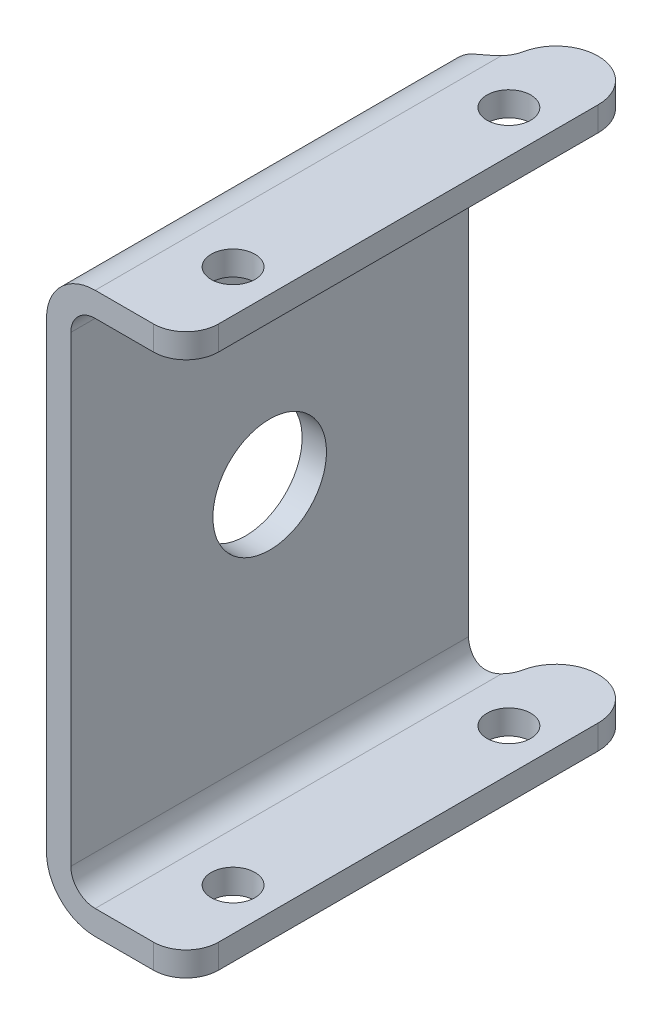
from build123d import *

# Parameters (mm, degrees)
BOSS_EXTRUDE1_DEPTH = 14
SKETCH2_R           = 1.35
CUT_EXTRUDE1_DEPTH  = 39.212694226
SKETCH4_R           = 1.742727666
CUT_EXTRUDE3_DEPTH  = 39.212694226
SKETCH3_R           = 3.5
CUT_EXTRUDE2_DEPTH  = 39.212694226
FILLET1_R           = 3
FILLET2_R           = 2
FILLET3_R           = 1.5


with BuildPart() as part:
    # Sketch1 → Boss-Extrude1 (new, symmetric)
    with BuildSketch(Plane.XY):
        Polygon((0, 0), (0, 34.5), (8.6, 34.5), (8.6, 33), (1.5, 33), (1.5, 1.5), (8.6, 1.5), (8.6, 0), align=None)
    extrude(amount=BOSS_EXTRUDE1_DEPTH, both=True)

    # Sketch2 → Cut-Extrude1 (cut, through all)
    with BuildSketch(Plane(origin=(0, 34.5, 0), x_dir=(1, 0, 0), z_dir=(0, 1, 0))):
        with Locations(Location((6, 8.5, 0), (0, 0, 180))):
            Circle(SKETCH2_R)
        with Locations(Location((6, -8.5, 0), (0, 0, 180))):
            Circle(SKETCH2_R)
    extrude(amount=-CUT_EXTRUDE1_DEPTH, mode=Mode.SUBTRACT)

    # Sketch4 → Cut-Extrude3 (cut, through all)
    with BuildSketch(Plane(origin=(0, 34.5, 0), x_dir=(1, 0, 0), z_dir=(0, 1, 0))):
        with BuildLine():
            Line((8.6, 14), (6, 14))
            ThreePointArc((6, 14), (7.838477631, 13.238477631), (8.6, 11.4))
            Line((8.6, 11.4), (8.6, 14))
        make_face()
        Polygon((0, 14.708926335), (0, 14), (1.742727666, 14), (6, 14), (8.6, 14), (8.6, 11.4), (10.428656455, 11.4), (10.428656455, 14.708926335), align=None)
        with BuildLine():
            ThreePointArc((3.485455332, 12.257272334), (3.47686088, 12.084409052), (3.451162292, 11.913250757))
            ThreePointArc((3.451162292, 11.913250757), (4.352949905, 13.411771852), (6, 14))
            Line((6, 14), (1.742727666, 14))
            ThreePointArc((1.742727666, 14), (2.975022216, 13.489566884), (3.485455332, 12.257272334))
        make_face()
        with Locations((1.742727666, 12.257272334)):
            Circle(SKETCH4_R)
        with BuildLine():
            Line((0, 14), (0, 12.257272334))
            ThreePointArc((0, 12.257272334), (0.510433116, 13.489566884), (1.742727666, 14))
            Line((1.742727666, 14), (0, 14))
        make_face()
        with BuildLine():
            Line((0, 10.514544668), (1.742727666, 10.514544668))
            ThreePointArc((1.742727666, 10.514544668), (0.510433116, 11.024977784), (0, 12.257272334))
            Line((0, 12.257272334), (0, 10.514544668))
        make_face()
    extrude(amount=-CUT_EXTRUDE3_DEPTH, mode=Mode.SUBTRACT)

    # Sketch3 → Cut-Extrude2 (cut, through all)
    with BuildSketch(Plane.ZY):
        with Locations((1.742727666, 17.25)):
            Circle(SKETCH3_R)
    extrude(amount=-CUT_EXTRUDE2_DEPTH, mode=Mode.SUBTRACT)

    # Fillet1
    fillet1_edges = [part.edges().sort_by_distance(p)[0] for p in [
        (0, 0, 1.742727666),
        (0, 34.5, 1.742727666),
    ]]
    fillet(fillet1_edges, radius=FILLET1_R)

    # Fillet2
    fillet2_edges = [part.edges().sort_by_distance(p)[0] for p in [
        (8.6, 33.75, 14),
        (8.6, 0.75, 14),
    ]]
    fillet(fillet2_edges, radius=FILLET2_R)

    # Fillet3
    fillet3_edges = [part.edges().sort_by_distance(p)[0] for p in [
        (1.5, 1.5, 1.742727666),
        (1.5, 33, 1.742727666),
    ]]
    fillet(fillet3_edges, radius=FILLET3_R)


solid = part.part
